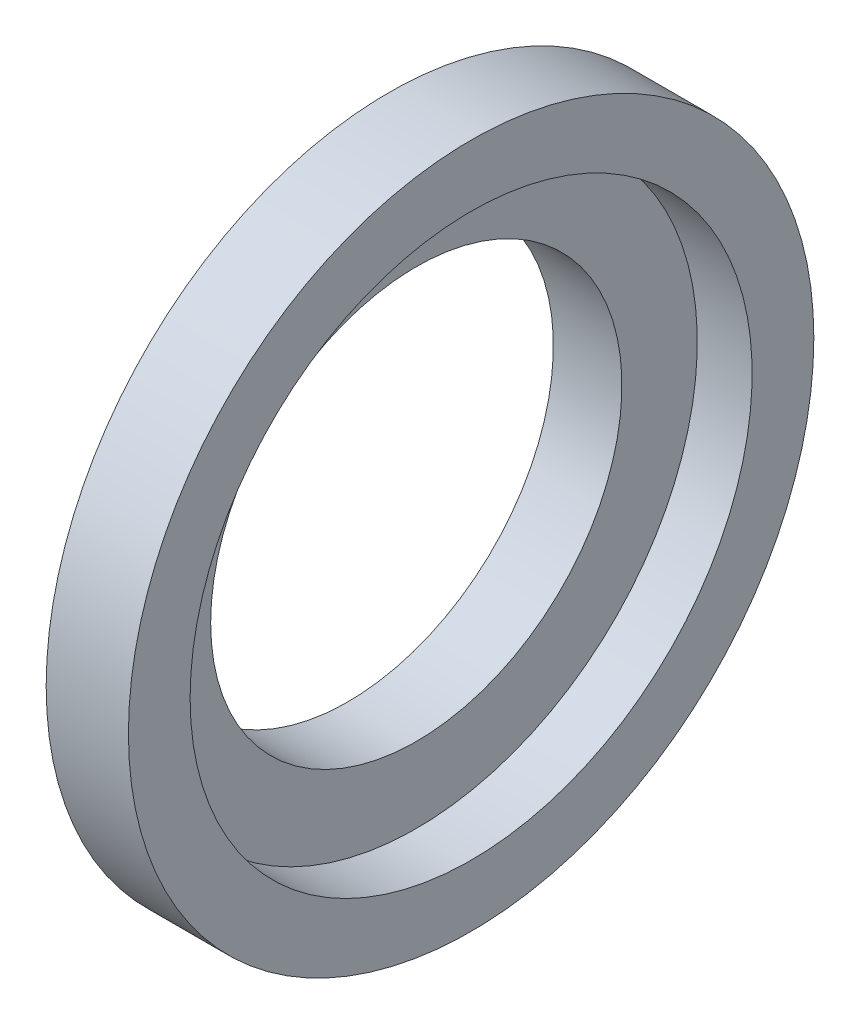
from build123d import *


with BuildPart() as part:
    # Sketch1 → Revolve1 (revolve)
    with BuildSketch(Plane.XY, mode=Mode.PRIVATE) as revolve1_sk:
        Polygon((-26.575342466, 30), (-16.575342466, 30), (-16.575342466, 41), (-8.575342466, 41), (-8.575342466, 50), (-20.575342466, 50), (-26.575342466, 36), align=None)
    revolve(revolve1_sk.sketch.rotate(Axis((-40.273972603, 0, 0), (1, 0, 0)), 90), axis=Axis((-40.273972603, 0, 0), (1, 0, 0)))


solid = part.part
